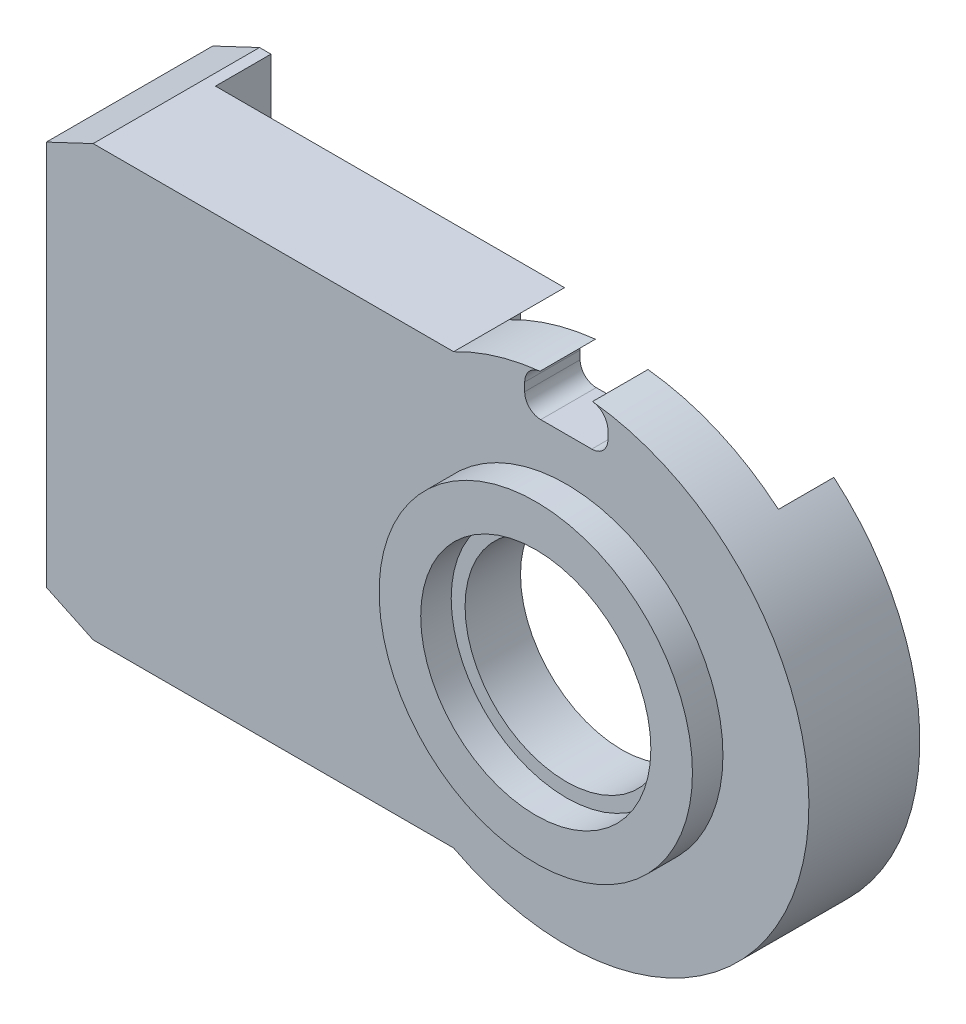
from build123d import *

# Parameters (mm, degrees)
SKETCH_310_R           = 3.65
EXTRUDE_1379_DEPTH     = 4
SKETCH_1_3_R           = 3.65
CUT_EXTRUDE_1435_DEPTH = 2
CUT_EXTRUDE_2054_DEPTH = 2
EXTRUDE_2114_DEPTH     = 2
SKETCH_4_R             = 5.65
SKETCH_4_R_2           = 4.15
EXTRUDE_4_DEPTH        = 1.1


with BuildPart() as part:
    # Sketch 310 → Extrude 1379 (new body)
    with BuildSketch(Plane.XY):
        with BuildLine():
            Line((-4.062019202, 7.75), (-17.062019202, 7.75))
            Line((-17.062019202, 7.75), (-18.75, 6.953209217))
            Line((-18.75, 6.953209217), (-18.75, -6.953209217))
            Line((-18.75, -6.953209217), (-17.062019202, -7.75))
            Line((-17.062019202, -7.75), (-4.062019202, -7.75))
            ThreePointArc((-4.062019202, -7.75), (8.75, 0), (-4.062019202, 7.75))
        make_face()
        Circle(SKETCH_310_R, mode=Mode.SUBTRACT)
    extrude(amount=EXTRUDE_1379_DEPTH)

    # Эскиз1<3> → Cut-Extrude 1435 (cut)
    with BuildSketch(Plane.XY):
        with BuildLine():
            Line((5.65, -6.681317235), (5.65, 6.681317235))
            ThreePointArc((5.65, 6.681317235), (0, 8.75), (-5.65, 6.681317235))
            Line((-5.65, 6.681317235), (-5.65, -6.681317235))
            ThreePointArc((-5.65, -6.681317235), (0, -8.75), (5.65, -6.681317235))
        make_face()
        Circle(SKETCH_1_3_R, mode=Mode.SUBTRACT)
    extrude(amount=CUT_EXTRUDE_1435_DEPTH, mode=Mode.SUBTRACT)

    # Sketch 1681 → Cut-Extrude 2054 (cut)
    with BuildSketch(Plane(origin=(0, 0, 2), x_dir=(-1, 0, 0), z_dir=(0, 0, -1))):
        with BuildLine():
            Line((-1.5, 7.78), (-1.5, 8.082233602))
            ThreePointArc((-1.5, 8.082233602), (-1.341523495, 8.496233679), (-0.947109471, 8.6985909))
            ThreePointArc((-0.947109471, 8.6985909), (0, 8.75), (0.947109471, 8.6985909))
            ThreePointArc((0.947109471, 8.6985909), (1.341523495, 8.496233679), (1.5, 8.082233602))
            Line((1.5, 8.082233602), (1.5, 7.78))
            ThreePointArc((1.5, 7.78), (1.330121933, 7.369878067), (0.92, 7.2))
            Line((0.92, 7.2), (-0.92, 7.2))
            ThreePointArc((-0.92, 7.2), (-1.330121933, 7.369878067), (-1.5, 7.78))
        make_face()
    extrude(amount=-CUT_EXTRUDE_2054_DEPTH, mode=Mode.SUBTRACT)

    # Эскиз1<5> → Extrude 2114 (add)
    with BuildSketch(Plane.XY):
        Polygon((-16.65, -7.75), (-16.65, 7.75), (-17.062019202, 7.75), (-18.75, 6.953209217), (-18.75, -6.953209217), (-17.062019202, -7.75), align=None)
    extrude(amount=-EXTRUDE_2114_DEPTH)

    # Эскиз4 → Бобышка-Вытянуть4 (add)
    with BuildSketch(Plane.XY.offset(4)):
        Circle(SKETCH_4_R)
        Circle(SKETCH_4_R_2, mode=Mode.SUBTRACT)
    extrude(amount=EXTRUDE_4_DEPTH)


solid = part.part
